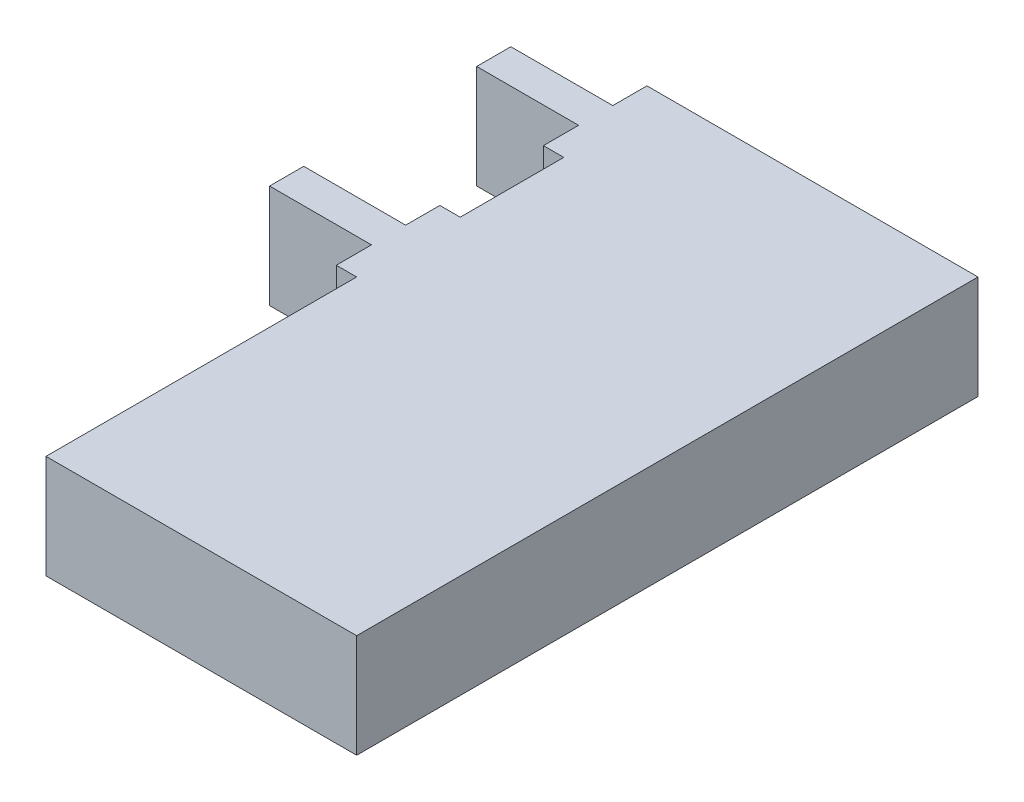
from build123d import *

# Parameters (mm, degrees)
SKETCH1_W      = 76.2
SKETCH1_H      = 152.4
EXTRUDE1_DEPTH = 25.4
SKETCH2_W      = 25.4
SKETCH2_H      = 25.4
EXTRUDE2_DEPTH = 5
SKETCH3_W      = 8.382
SKETCH3_H      = 25.4
EXTRUDE3_DEPTH = 25
SKETCH4_W      = 25.4
SKETCH4_H      = 25.4
EXTRUDE4_DEPTH = 5
SKETCH5_W      = 8.382
SKETCH5_H      = 25.4
EXTRUDE5_DEPTH = 25


with BuildPart() as part:
    # Sketch1 → Extrude1 (new body)
    with BuildSketch(Plane(origin=(0, 0, 0), x_dir=(1, 0, 0), z_dir=(0, 1, 0))):
        Rectangle(SKETCH1_W, SKETCH1_H)
    extrude(amount=EXTRUDE1_DEPTH)

    # Sketch2 → Extrude2 (add)
    with BuildSketch(Plane.ZY.offset(38.1)):
        with Locations((-63.5, 12.7)):
            Rectangle(SKETCH2_W, SKETCH2_H)
    extrude(amount=EXTRUDE2_DEPTH)

    # Sketch3 → Extrude3 (add)
    with BuildSketch(Plane.ZY.offset(43.1)):
        with Locations((-63.627, 12.7)):
            Rectangle(SKETCH3_W, SKETCH3_H)
    extrude(amount=EXTRUDE3_DEPTH)

    # Sketch4 → Extrude4 (add)
    with BuildSketch(Plane.ZY.offset(38.1)):
        with Locations((-12.7, 12.7)):
            Rectangle(SKETCH4_W, SKETCH4_H)
    extrude(amount=EXTRUDE4_DEPTH)

    # Sketch5 → Extrude5 (add)
    with BuildSketch(Plane.ZY.offset(43.1)):
        with Locations((-12.827, 12.7)):
            Rectangle(SKETCH5_W, SKETCH5_H)
    extrude(amount=EXTRUDE5_DEPTH)


solid = part.part
